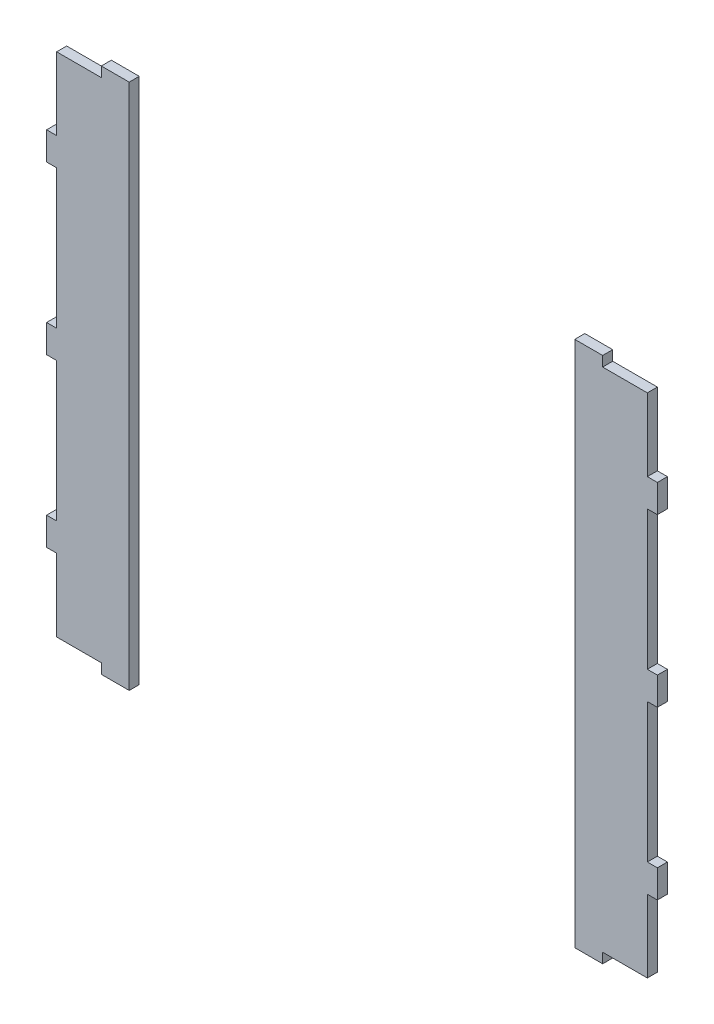
from build123d import *

# Parameters (mm, degrees)
BOSS_EXTRUDE1_DEPTH = 18
CUT_EXTRUDE1_DEPTH  = 1268.443443295


with BuildPart() as part:
    # Sketch1 → Boss-Extrude1 (new body)
    with BuildSketch(Plane.XY):
        Polygon((-961.236516538, 328.950735931), (-961.236516538, 378.950735931), (-943.236516538, 378.950735931), (-943.236516538, 627.901471863), (-961.236516538, 627.901471863), (-961.236516538, 677.901471863), (-943.236516538, 677.901471863), (-943.236516538, 807.901471863), (-863.236516538, 807.901471863), (-863.236516538, 825.901471863), (-813.236516538, 825.901471863), (-813.236516538, 807.901471863), (-439.118258269, 807.901471863), (-439.118258269, 825.901471863), (-389.118258269, 825.901471863), (-389.118258269, 807.901471863), (-15, 807.901471863), (-15, 825.901471863), (35, 825.901471863), (35, 807.901471863), (115, 807.901471863), (115, 677.901471863), (133, 677.901471863), (133, 627.901471863), (115, 627.901471863), (115, 378.950735931), (133, 378.950735931), (133, 328.950735931), (115, 328.950735931), (115, 80), (133, 80), (133, 30), (115, 30), (115, -100), (35, -100), (35, -118), (-15, -118), (-15, -100), (-389.118258269, -100), (-389.118258269, -118), (-439.118258269, -118), (-439.118258269, -100), (-813.236516538, -100), (-813.236516538, -118), (-863.236516538, -118), (-863.236516538, -100), (-943.236516538, -100), (-943.236516538, 30), (-961.236516538, 30), (-961.236516538, 80), (-943.236516538, 80), (-943.236516538, 328.950735931), align=None)
    extrude(amount=BOSS_EXTRUDE1_DEPTH)

    # Sketch2 → Cut-Extrude1 (cut, through all)
    with BuildSketch(Plane(origin=(0, 0, 0), x_dir=(-1, 0, 0), z_dir=(0, 0, -1))):
        Polygon((389.118258269, -100), (389.118258269, -118), (439.118258269, -118), (439.118258269, -100), (813.236516538, -100), (813.236516538, 807.901471863), (439.118258269, 807.901471863), (439.118258269, 825.901471863), (389.118258269, 825.901471863), (389.118258269, 807.901471863), (15, 807.901471863), (15, -100), align=None)
    extrude(amount=-CUT_EXTRUDE1_DEPTH, mode=Mode.SUBTRACT)


with BuildPart() as cut_extrude1_piece_1:
    # of the separate pieces the step leaves, piece 1, a body of its own (cut_extrude1_pieces)
    add(part.part.solids().sort_by_distance((-15, -118, 0))[0])


with BuildPart() as cut_extrude1_piece_2:
    # of the separate pieces the step leaves, piece 2, a body of its own (cut_extrude1_pieces)
    add(part.part.solids().sort_by_distance((-961.236516538, 328.950735931, 0))[0])


solid = Compound([cut_extrude1_piece_1.part, cut_extrude1_piece_2.part])
